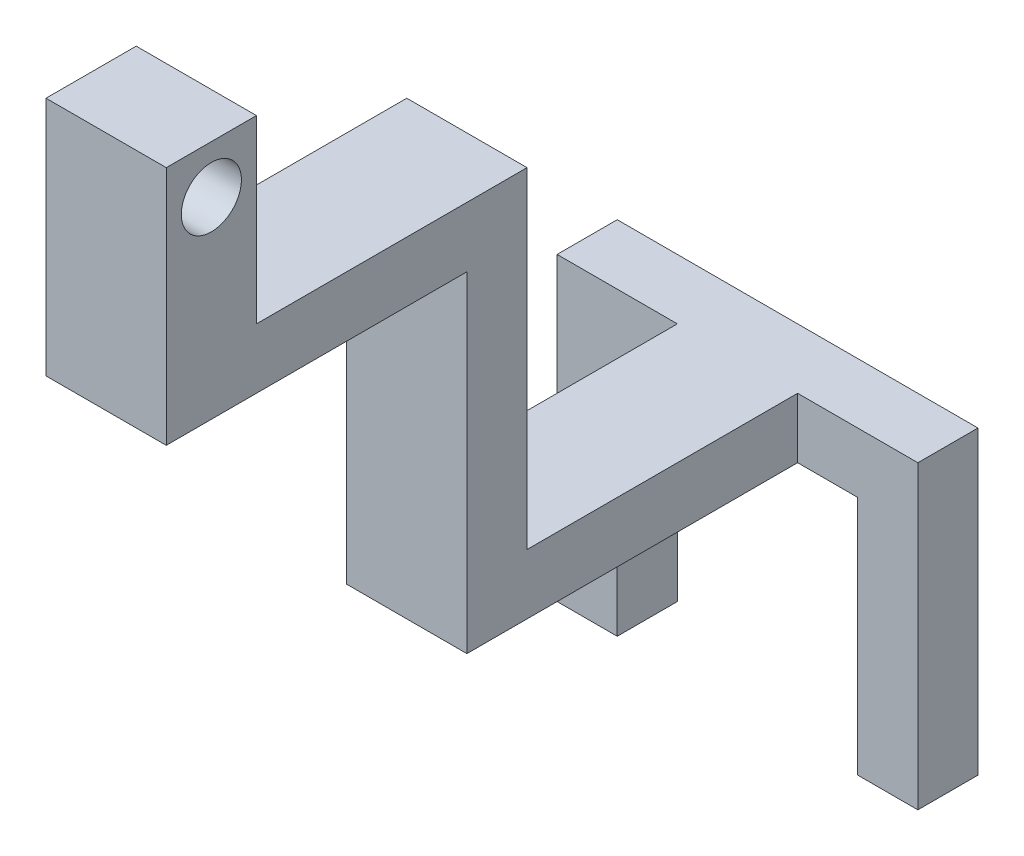
from build123d import *

# Parameters (mm, degrees)
P_IDAT_VYSUNUT_M1_DEPTH  = 10
SKICA2_W                 = 20
SKICA2_H                 = 10
P_IDAT_VYSUNUT_M2_DEPTH  = 55
SKICA4_W                 = 20
SKICA4_H                 = 10
P_IDAT_VYSUNUT_M3_DEPTH  = 55
SKICA5_W                 = 20
SKICA5_H                 = 10
P_IDAT_VYSUNUT_M4_DEPTH  = 50
SKICA6_W                 = 20
SKICA6_H                 = 15
P_IDAT_VYSUNUT_M5_DEPTH  = 30
SKICA7_R                 = 5
ODEBRAT_VYSUNUT_M1_DEPTH = 20


with BuildPart() as part:
    # Skica1 → Přidat vysunutím1 (new body)
    with BuildSketch(Plane.XY):
        Polygon((0, 0), (60, 0), (60, -50), (50, -50), (50, -10), (10, -10), (10, -50), (0, -50), align=None)
    extrude(amount=P_IDAT_VYSUNUT_M1_DEPTH)

    # Skica2 → Přidat vysunutím2 (add)
    with BuildSketch(Plane.XY.offset(10)):
        with Locations((30, -5)):
            Rectangle(SKICA2_W, SKICA2_H)
    extrude(amount=P_IDAT_VYSUNUT_M2_DEPTH)

    # Skica4 → Přidat vysunutím3 (add)
    with BuildSketch(Plane(origin=(0, 0, 0), x_dir=(1, 0, 0), z_dir=(0, 1, 0))):
        with Locations((30, -60)):
            Rectangle(SKICA4_W, SKICA4_H)
    extrude(amount=P_IDAT_VYSUNUT_M3_DEPTH)

    # Skica5 → Přidat vysunutím4 (add)
    with BuildSketch(Plane.XY.offset(65)):
        with Locations((30, 50)):
            Rectangle(SKICA5_W, SKICA5_H)
    extrude(amount=P_IDAT_VYSUNUT_M4_DEPTH)

    # Skica6 → Přidat vysunutím5 (add)
    with BuildSketch(Plane(origin=(0, 55, 0), x_dir=(1, 0, 0), z_dir=(0, 1, 0))):
        with Locations((30, -107.5)):
            Rectangle(SKICA6_W, SKICA6_H)
    extrude(amount=P_IDAT_VYSUNUT_M5_DEPTH)

    # Skica7 → Odebrat vysunutím1 (cut)
    with BuildSketch(Plane(origin=(40, 0, 0), x_dir=(0, 0, -1), z_dir=(1, 0, 0))):
        with Locations((-107.5, 77)):
            Circle(SKICA7_R)
    extrude(amount=-ODEBRAT_VYSUNUT_M1_DEPTH, mode=Mode.SUBTRACT)


solid = part.part
